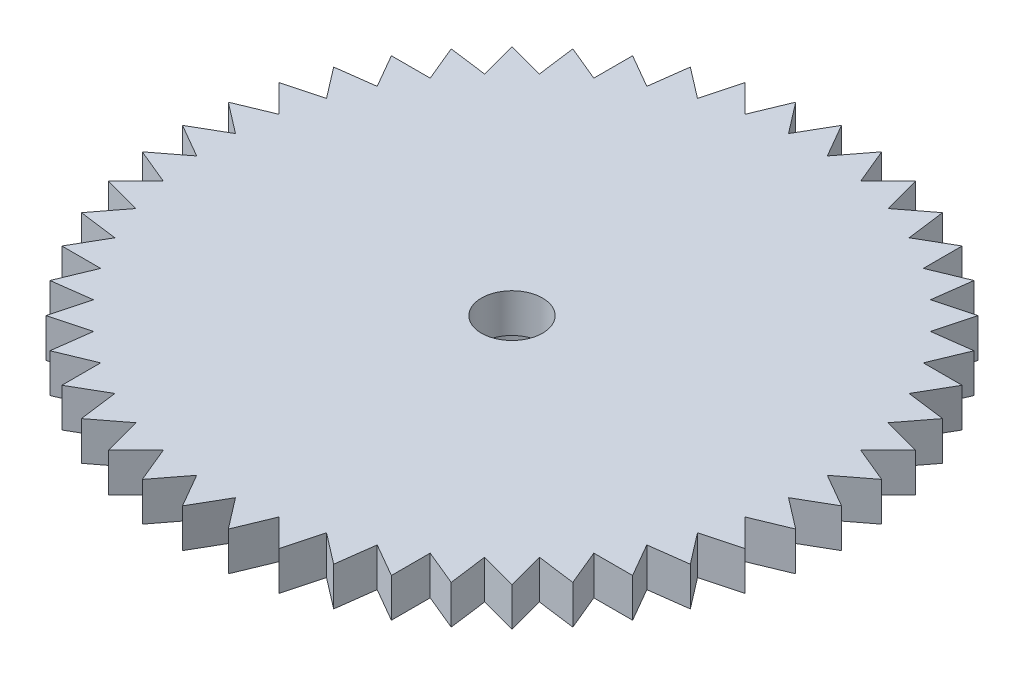
from build123d import *

# Parameters (mm, degrees)
SKETCH1_R           = 15.24
BOSS_EXTRUDE1_DEPTH = 5.08
BOSS_EXTRUDE3_DEPTH = 2.54
CIRPATTERN1_COUNT   = 48
SKETCH6_R           = 4.064
CUT_EXTRUDE1_DEPTH  = 2.54
SKETCH7_R           = 2.000000064
CUT_EXTRUDE2_DEPTH  = 2.54


with BuildPart() as part:
    # Sketch1 → Boss-Extrude1 (new body)
    with BuildSketch(Plane(origin=(0, 0, 0), x_dir=(1, 0, 0), z_dir=(0, 1, 0))):
        Circle(SKETCH1_R)
    extrude(amount=BOSS_EXTRUDE1_DEPTH)

    # Sketch3 → Boss-Extrude3 (add)
    with BuildSketch(Plane(origin=(0, 5.08, 0), x_dir=(1, 0, 0), z_dir=(0, 1, 0))):
        Polygon((0, 21.59), (3.969953129, 14.713839477), (-3.969953129, 14.713839477), align=None)
    boss_extrude3 = extrude(amount=-BOSS_EXTRUDE3_DEPTH)

    # CirPattern1: Boss-Extrude3 ×48 about axis
    cirpattern1_axis = Axis((0, -0.127, 0), (0, 1, 0))
    for i in range(1, CIRPATTERN1_COUNT):
        add(boss_extrude3.rotate(cirpattern1_axis, i * 360 / CIRPATTERN1_COUNT))

    # Sketch6 → Cut-Extrude1 (cut)
    with BuildSketch(Plane.XZ):
        Circle(SKETCH6_R)
    extrude(amount=-CUT_EXTRUDE1_DEPTH, mode=Mode.SUBTRACT)

    # Sketch7 → Cut-Extrude2 (cut)
    with BuildSketch(Plane(origin=(0, 5.08, 0), x_dir=(1, 0, 0), z_dir=(0, 1, 0))):
        Circle(SKETCH7_R)
    extrude(amount=-CUT_EXTRUDE2_DEPTH, mode=Mode.SUBTRACT)


solid = part.part
